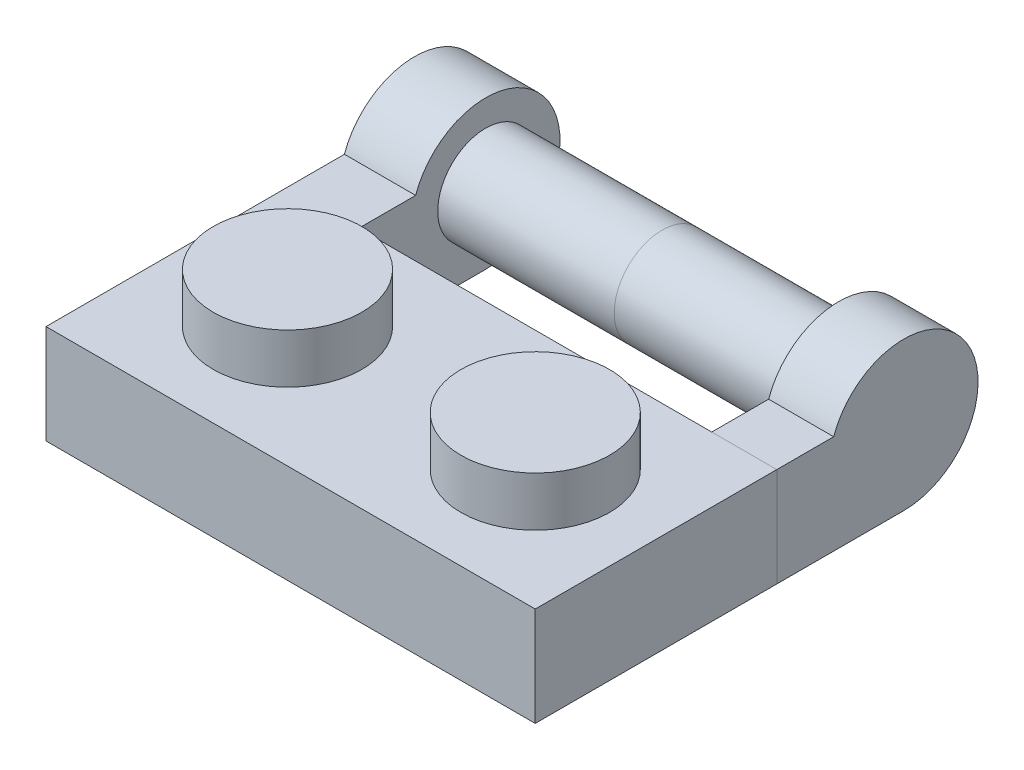
from build123d import *

# Parameters (mm, degrees)
SKETCH1_W            = 15.8
SKETCH1_H            = 3.2
BOSS_EXTRUDE1_DEPTH  = 7.8
SKETCH2_R            = 2.4
BOSS_EXTRUDE2_DEPTH  = 1.6
LPATTERN1_COUNT      = 2
LPATTERN1_PITCH      = 8
LPATTERN1_COUNT_DIR2 = 4
LPATTERN1_PITCH_DIR2 = 8
SHELL1_T             = -1.2
SKETCH3_R            = 1.5
SKETCH3_R_2          = 0.6
BOSS_EXTRUDE3_DEPTH  = 1.8
BOSS_EXTRUDE4_DEPTH  = 2.1
SKETCH5_R            = 1.55
BOSS_EXTRUDE5_DEPTH  = 5.7
BOSS_EXTRUDE6_DEPTH  = 0.2


with BuildPart() as part:
    # Sketch1 → Boss-Extrude1 (new body)
    with BuildSketch(Plane.XY):
        with Locations((7.9, 1.6)):
            Rectangle(SKETCH1_W, SKETCH1_H)
    extrude(amount=-BOSS_EXTRUDE1_DEPTH)

    # Sketch2 → Boss-Extrude2 (add)
    with BuildSketch(Plane(origin=(0, 3.2, 0), x_dir=(1, 0, 0), z_dir=(0, 1, 0))):
        with Locations(Location((3.9, 3.9, 0), (0, 0, 270))):
            Circle(SKETCH2_R)
    boss_extrude2 = extrude(amount=BOSS_EXTRUDE2_DEPTH)

    # LPattern1: Boss-Extrude2 2 × 4, 6 skipped
    with Locations(*[(j * LPATTERN1_PITCH_DIR2, 0, i * LPATTERN1_PITCH) for i in range(LPATTERN1_COUNT) for j in range(LPATTERN1_COUNT_DIR2) if (i, j) not in ((0, 0), (0, 2), (0, 3), (1, 0), (1, 1), (1, 2), (1, 3))]):
        add(boss_extrude2)

    # Shell1
    shell1_openings = [part.faces().sort_by_distance(p)[0] for p in [
        (7.9, 0, -3.9),
    ]]
    offset(amount=SHELL1_T, openings=shell1_openings, kind=Kind.INTERSECTION)

    # Sketch3 → Boss-Extrude3 (add)
    with BuildSketch(Plane.XZ.offset(-2)):
        with Locations(Location((7.9, -3.9, 0), (0, 0, 90))):
            Circle(SKETCH3_R)
        with Locations(Location((7.9, -3.9, 0), (0, 0, 270))):
            Circle(SKETCH3_R_2, mode=Mode.SUBTRACT)
    extrude(amount=BOSS_EXTRUDE3_DEPTH)



with BuildPart() as body_2:
    # Sketch4 → Boss-Extrude4 (new body)
    with BuildSketch(Plane(origin=(15.8, 0, 0), x_dir=(0, 0, -1), z_dir=(1, 0, 0))):
        with BuildLine():
            Line((7.8, 3.2), (9.6372583, 3.2))
            ThreePointArc((9.6372583, 3.2), (13.859591794, 3.785640646), (11.9, 0))
            Line((11.9, 0), (7.8, 0))
            Line((7.8, 0), (7.8, 3.2))
        make_face()
    extrude(amount=-BOSS_EXTRUDE4_DEPTH)

    # Sketch5 → Boss-Extrude5 (add)
    with BuildSketch(Plane.ZY.offset(-13.7)):
        with Locations(Location((-11.9, 2.4, 0), (0, 0, 180))):
            Circle(SKETCH5_R)
    extrude(amount=BOSS_EXTRUDE5_DEPTH)


with BuildPart() as body_3:
    # Mirror2: mirrored copy
    add(body_2.part.mirror(Plane(origin=(8, 0, 0), x_dir=(0, 0, 1), z_dir=(1, 0, 0))))


with BuildPart() as part_1:
    add(part.part)

    add(body_3.part)  # Boss-Extrude6 merges body 3
    # Sketch6 → Boss-Extrude6 (add)
    with BuildSketch(Plane.ZY.offset(-0.2)):
        with BuildLine():
            Line((-7.8, 0), (-7.8, 3.2))
            Line((-7.8, 3.2), (-9.6372583, 3.2))
            ThreePointArc((-9.6372583, 3.2), (-13.859591794, 3.785640646), (-11.9, 0))
            Line((-11.9, 0), (-7.8, 0))
        make_face()
    extrude(amount=BOSS_EXTRUDE6_DEPTH)


solid = Compound([body_2.part, part_1.part])
